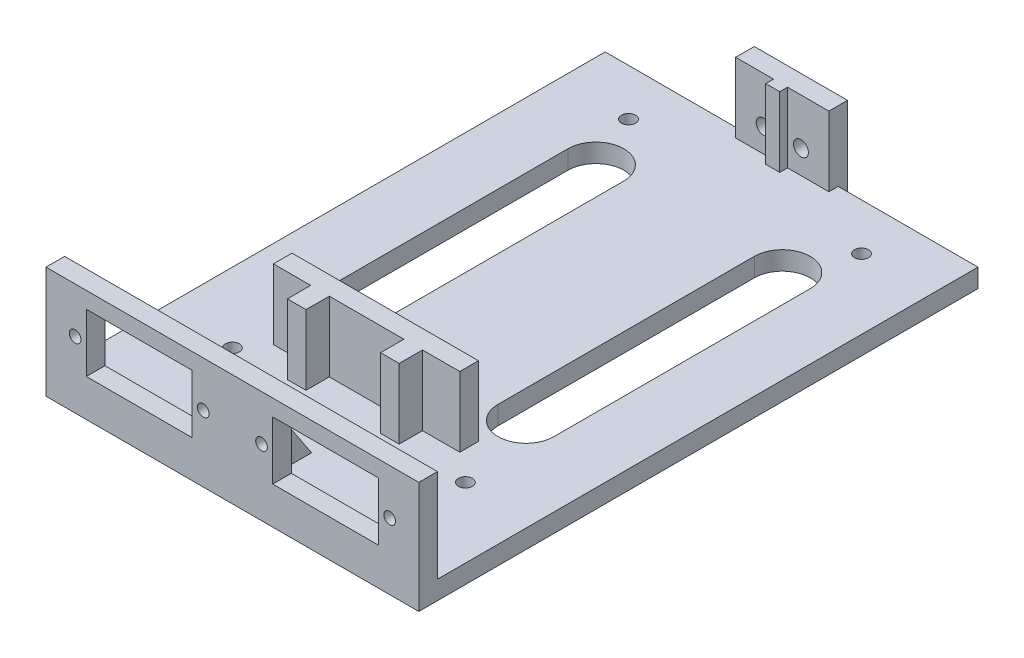
from build123d import *
from build123d.topology import SkipClean

# Parameters (mm, degrees)
SKETCH_1_W           = 80
SKETCH_1_H           = 120
SKETCH_1_R           = 1.5
EXTRUDE_2_DEPTH      = 4
SKETCH_4_W           = 4
SKETCH_4_H           = 10
EXTRUDE_4_DEPTH      = 20
EXTRUDE_5_DEPTH      = 15
EXTRUDE_5_DEPTH_BACK = 10
SKETCH_5_W           = 20
SKETCH_5_H           = 4
CUT_EXTRUDE_1_REACH  = 132.959
SKETCH_6_R           = 1.6
CUT_EXTRUDE_START    = -50
CUT_EXTRUDE_3_DEPTH  = 50
EXTRUDE_7_DEPTH      = 15
EXTRUDE_7_DEPTH_BACK = 10
SKETCH_10_W          = 3
SKETCH_10_H          = 3
SKETCH_11_W          = 4
SKETCH_11_H          = 5
EXTRUDE_9_DEPTH      = 15
CUT_EXTRUDE_5_REACH  = 102.708
CUT_EXTRUDE_6_REACH  = 129.241
SKETCH_13_R          = 1.25
SKETCH_13_W          = 22.7
SKETCH_13_H          = 12.5
CUT_EXTRUDE_7_DEPTH  = 114.370984798
SKETCH_15_W          = 6
SKETCH_15_H          = 10
EXTRUDE_10_DEPTH     = 15
CUT_EXTRUDE_8_REACH  = 104.357
EXTRUDE_START        = 3
SKETCH_17_R          = 3
SKETCH_17_R_2        = 1.5
EXTRUDE_11_DEPTH     = 3


with BuildPart() as part:
    # 草图1 → 凸台-拉伸2 (new body)
    with BuildSketch(Plane(origin=(0, 0, 0), x_dir=(1, 0, 0), z_dir=(0, 1, 0))):
        with Locations((1.11138133, -29.732826736)):
            Rectangle(SKETCH_1_W, SKETCH_1_H)
        with Locations(Location((-23.88861867, 20.267173264, 0), (0, 0, 270))):
            Circle(SKETCH_1_R, mode=Mode.SUBTRACT)
        with Locations(Location((26.11138133, 20.267173264, 0), (0, 0, 270))):
            Circle(SKETCH_1_R, mode=Mode.SUBTRACT)
        with Locations(Location((-23.88861867, -64.732826736, 0), (0, 0, 270))):
            Circle(SKETCH_1_R, mode=Mode.SUBTRACT)
        with Locations(Location((26.11138133, -64.732826736, 0), (0, 0, 270))):
            Circle(SKETCH_1_R, mode=Mode.SUBTRACT)
    extrude(amount=EXTRUDE_2_DEPTH)

    # 草图4 → 凸台-拉伸4 (add)
    with BuildSketch(Plane(origin=(0, 4, 0), x_dir=(1, 0, 0), z_dir=(0, 1, 0))):
        Polygon((-38.88861867, -85.732826736), (-38.88861867, -89.732826736), (41.11138133, -89.732826736), (41.11138133, -85.732826736), (26.11138133, -85.732826736), (22.11138133, -85.732826736), (-19.88861867, -85.732826736), (-23.88861867, -85.732826736), align=None)
        with Locations((24.11138133, -80.732826736)):
            Rectangle(SKETCH_4_W, SKETCH_4_H)
        with Locations((-21.88861867, -80.732826736)):
            Rectangle(SKETCH_4_W, SKETCH_4_H)
    extrude(amount=EXTRUDE_4_DEPTH)

    # 草图5 → 凸台-拉伸5 (add, two sides: drawn at the far end of the back side and taken through both)
    with BuildSketch(Plane(origin=(0, 4, 0), x_dir=(1, 0, 0), z_dir=(0, 1, 0)).offset(-EXTRUDE_5_DEPTH_BACK)):
        with Locations((1.11138133, 30.267173264)):
            Rectangle(SKETCH_5_W, SKETCH_5_H)
    extrude(amount=EXTRUDE_5_DEPTH + EXTRUDE_5_DEPTH_BACK)

    # 草图6 → 切除-拉伸1 (cut, up to next)
    with BuildSketch(Plane(origin=(0, 0, -32.267173264), x_dir=(-1, 0, 0), z_dir=(0, 0, -1)), mode=Mode.PRIVATE) as cut_extrude_1_sk1:
        with Locations((2.88861867, 9.096659339)):
            Circle(SKETCH_6_R)
    cut_extrude_1_tool1 = extrude(cut_extrude_1_sk1.sketch, amount=-CUT_EXTRUDE_1_REACH, mode=Mode.PRIVATE) & part.part
    # 草图6 → 切除-拉伸1 (cut, up to next)
    with BuildSketch(Plane(origin=(0, 0, -32.267173264), x_dir=(-1, 0, 0), z_dir=(0, 0, -1)), mode=Mode.PRIVATE) as cut_extrude_1_sk2:
        with Locations((-5.11138133, 9.096659339)):
            Circle(SKETCH_6_R)
    cut_extrude_1_tool2 = extrude(cut_extrude_1_sk2.sketch, amount=-CUT_EXTRUDE_1_REACH, mode=Mode.PRIVATE) & part.part
    add(cut_extrude_1_tool1.solids().sort_by_distance((-2.888619, 9.096659, -32.267173))[0], mode=Mode.SUBTRACT)
    add(cut_extrude_1_tool2.solids().sort_by_distance((5.111381, 9.096659, -32.267173))[0], mode=Mode.SUBTRACT)

    # 草图9 → 切除-拉伸3 (cut)
    with BuildSketch(Plane.ZY.offset(23.88861867).offset(CUT_EXTRUDE_START)):
        Polygon((75.732826736, 24), (75.732826736, 4), (85.732826736, 14), (85.732826736, 24), align=None)
    extrude(amount=CUT_EXTRUDE_3_DEPTH, mode=Mode.SUBTRACT)

    # 草图10 → 凸台-拉伸7 (add, two sides: drawn at the far end of the back side and taken through both)
    with BuildSketch(Plane(origin=(0, 4, 0), x_dir=(1, 0, 0), z_dir=(0, 1, 0)).offset(-EXTRUDE_7_DEPTH_BACK)):
        with Locations((0.730413479, 28.094677972)):
            Rectangle(SKETCH_10_W, SKETCH_10_H)
    extrude(amount=EXTRUDE_7_DEPTH + EXTRUDE_7_DEPTH_BACK)

    # 草图11 → 凸台-拉伸9 (add)
    with BuildSketch(Plane(origin=(0, 4, 0), x_dir=(1, 0, 0), z_dir=(0, 1, 0))):
        Polygon((19.905778303, -55.732826736), (-20.094221697, -55.732826736), (-20.094221697, -59.732826736), (-12.422102113, -59.732826736), (-12.094221697, -59.732826736), (-9.202998314, -59.732826736), (-8.094221697, -59.732826736), (7.905778303, -59.732826736), (11.905778303, -59.732826736), (19.905778303, -59.732826736), align=None)
        Polygon((-9.202998314, -59.732826736), (-12.094221697, -59.732826736), (-12.094221697, -64.732826736), (-8.094221697, -64.732826736), (-8.094221697, -59.732826736), align=None)
        with Locations((9.905778303, -62.232826736)):
            Rectangle(SKETCH_11_W, SKETCH_11_H)
    extrude(amount=EXTRUDE_9_DEPTH)

    # 草图12 → 切除-拉伸5 (cut, up to next)
    with BuildSketch(Plane(origin=(0, 4, 0), x_dir=(1, 0, 0), z_dir=(0, 1, 0)), mode=Mode.PRIVATE) as cut_extrude_5_sk1:
        with BuildLine():
            Line((27.11138133, 8.267173264), (27.11138133, -46.732826736))
            ThreePointArc((27.11138133, -46.732826736), (21.11138133, -52.732826736), (15.11138133, -46.732826736))
            Line((15.11138133, -46.732826736), (15.11138133, 8.267173264))
            ThreePointArc((15.11138133, 8.267173264), (21.11138133, 14.267173264), (27.11138133, 8.267173264))
        make_face()
    cut_extrude_5_tool1 = extrude(cut_extrude_5_sk1.sketch, amount=-CUT_EXTRUDE_5_REACH, mode=Mode.PRIVATE) & part.part
    # 草图12 → 切除-拉伸5 (cut, up to next)
    with BuildSketch(Plane(origin=(0, 4, 0), x_dir=(1, 0, 0), z_dir=(0, 1, 0)), mode=Mode.PRIVATE) as cut_extrude_5_sk2:
        with BuildLine():
            Line((-12.88861867, 8.267173264), (-12.88861867, -46.732826736))
            ThreePointArc((-12.88861867, -46.732826736), (-18.88861867, -52.732826736), (-24.88861867, -46.732826736))
            Line((-24.88861867, -46.732826736), (-24.88861867, 8.267173264))
            ThreePointArc((-24.88861867, 8.267173264), (-18.88861867, 14.267173264), (-12.88861867, 8.267173264))
        make_face()
    cut_extrude_5_tool2 = extrude(cut_extrude_5_sk2.sketch, amount=-CUT_EXTRUDE_5_REACH, mode=Mode.PRIVATE) & part.part
    add(cut_extrude_5_tool1.solids().sort_by_distance((21.111381, 4, 19.232827))[0], mode=Mode.SUBTRACT)
    add(cut_extrude_5_tool2.solids().sort_by_distance((-18.888619, 4, 19.232827))[0], mode=Mode.SUBTRACT)

    # 草图13 → 切除-拉伸6 (cut, up to next)
    with BuildSketch(Plane(origin=(0, 0, 85.732826736), x_dir=(-1, 0, 0), z_dir=(0, 0, -1)), mode=Mode.PRIVATE) as cut_extrude_6_sk1:
        with Locations((-34.86138133, 14.25)):
            Circle(SKETCH_13_R)
    cut_extrude_6_tool1 = extrude(cut_extrude_6_sk1.sketch, amount=-CUT_EXTRUDE_6_REACH, mode=Mode.PRIVATE) & part.part
    # 草图13 → 切除-拉伸6 (cut, up to next)
    with BuildSketch(Plane(origin=(0, 0, 85.732826736), x_dir=(-1, 0, 0), z_dir=(0, 0, -1)), mode=Mode.PRIVATE) as cut_extrude_6_sk2:
        with Locations((-7.36138133, 14.25)):
            Circle(SKETCH_13_R)
    cut_extrude_6_tool2 = extrude(cut_extrude_6_sk2.sketch, amount=-CUT_EXTRUDE_6_REACH, mode=Mode.PRIVATE) & part.part
    # 草图13 → 切除-拉伸6 (cut, up to next)
    with BuildSketch(Plane(origin=(0, 0, 85.732826736), x_dir=(-1, 0, 0), z_dir=(0, 0, -1)), mode=Mode.PRIVATE) as cut_extrude_6_sk3:
        with Locations((5.13861867, 14.25)):
            Circle(SKETCH_13_R)
    cut_extrude_6_tool3 = extrude(cut_extrude_6_sk3.sketch, amount=-CUT_EXTRUDE_6_REACH, mode=Mode.PRIVATE) & part.part
    # 草图13 → 切除-拉伸6 (cut, up to next)
    with BuildSketch(Plane(origin=(0, 0, 85.732826736), x_dir=(-1, 0, 0), z_dir=(0, 0, -1)), mode=Mode.PRIVATE) as cut_extrude_6_sk4:
        with Locations((32.63861867, 14.25)):
            Circle(SKETCH_13_R)
    cut_extrude_6_tool4 = extrude(cut_extrude_6_sk4.sketch, amount=-CUT_EXTRUDE_6_REACH, mode=Mode.PRIVATE) & part.part
    # 草图13 → 切除-拉伸6 (cut, up to next)
    with BuildSketch(Plane(origin=(0, 0, 85.732826736), x_dir=(-1, 0, 0), z_dir=(0, 0, -1)), mode=Mode.PRIVATE) as cut_extrude_6_sk5:
        with Locations((-21.11138133, 14.25)):
            Rectangle(SKETCH_13_W, SKETCH_13_H)
    cut_extrude_6_tool5 = extrude(cut_extrude_6_sk5.sketch, amount=-CUT_EXTRUDE_6_REACH, mode=Mode.PRIVATE) & part.part
    # 草图13 → 切除-拉伸6 (cut, up to next)
    with BuildSketch(Plane(origin=(0, 0, 85.732826736), x_dir=(-1, 0, 0), z_dir=(0, 0, -1)), mode=Mode.PRIVATE) as cut_extrude_6_sk6:
        with Locations((18.88861867, 14.25)):
            Rectangle(SKETCH_13_W, SKETCH_13_H)
    cut_extrude_6_tool6 = extrude(cut_extrude_6_sk6.sketch, amount=-CUT_EXTRUDE_6_REACH, mode=Mode.PRIVATE) & part.part
    add(cut_extrude_6_tool1.solids().sort_by_distance((34.861381, 14.25, 85.732827))[0], mode=Mode.SUBTRACT)
    add(cut_extrude_6_tool2.solids().sort_by_distance((7.361381, 14.25, 85.732827))[0], mode=Mode.SUBTRACT)
    add(cut_extrude_6_tool3.solids().sort_by_distance((-5.138619, 14.25, 85.732827))[0], mode=Mode.SUBTRACT)
    add(cut_extrude_6_tool4.solids().sort_by_distance((-32.638619, 14.25, 85.732827))[0], mode=Mode.SUBTRACT)
    add(cut_extrude_6_tool5.solids().sort_by_distance((21.111381, 14.25, 85.732827))[0], mode=Mode.SUBTRACT)
    add(cut_extrude_6_tool6.solids().sort_by_distance((-18.888619, 14.25, 85.732827))[0], mode=Mode.SUBTRACT)

    # 草图14 → 切除-拉伸7 (cut, through all)
    with BuildSketch(Plane(origin=(26.11138133, 0, 0), x_dir=(0, 0, -1), z_dir=(1, 0, 0))):
        Polygon((-85.732826736, 4), (-75.732826736, 4), (-85.732826736, 14), (-85.732826736, 8), align=None)
    extrude(amount=-CUT_EXTRUDE_7_DEPTH, mode=Mode.SUBTRACT)

    # 草图15 → 凸台-拉伸10 (add)
    with BuildSketch(Plane(origin=(0, 4, 0), x_dir=(1, 0, 0), z_dir=(0, 1, 0))):
        with Locations((1.11138133, -80.732826736)):
            Rectangle(SKETCH_15_W, SKETCH_15_H)
    extrude(amount=EXTRUDE_10_DEPTH)

    # 草图16 → 切除-拉伸8 (cut, up to next)
    with BuildSketch(Plane(origin=(4.11138133, 0, 0), x_dir=(0, 0, -1), z_dir=(1, 0, 0)), mode=Mode.PRIVATE) as cut_extrude_8_sk1:
        Polygon((-85.732826736, 19), (-75.732826736, 4), (-75.732826736, 19), align=None)
    cut_extrude_8_tool1 = extrude(cut_extrude_8_sk1.sketch, amount=-CUT_EXTRUDE_8_REACH, mode=Mode.PRIVATE) & part.part
    add(cut_extrude_8_tool1.solids().sort_by_distance((4.111381, 14, 79.06616))[0], mode=Mode.SUBTRACT)

    # 草图17 → 凸台-拉伸11 (add)
    # profile 1 of 4: a face of its own
    with SkipClean():  # the faces are left unmerged after this step: merging them gives an invalid solid
        with BuildSketch(Plane.XZ.offset(EXTRUDE_START)):
            with Locations(Location((-23.88861867, 64.732826736, 0), (0, 0, 90))):
                Circle(SKETCH_17_R)
            with Locations(Location((-23.88861867, 64.732826736, 0), (0, 0, 270))):
                Circle(SKETCH_17_R_2, mode=Mode.SUBTRACT)
        # profile 2 of 4: a face of its own
        with BuildSketch(Plane.XZ.offset(EXTRUDE_START)):
            with Locations(Location((26.11138133, 64.732826736, 0), (0, 0, 90))):
                Circle(SKETCH_17_R)
            with Locations(Location((26.11138133, 64.732826736, 0), (0, 0, 270))):
                Circle(SKETCH_17_R_2, mode=Mode.SUBTRACT)
        # profile 3 of 4: a face of its own
        with BuildSketch(Plane.XZ.offset(EXTRUDE_START)):
            with Locations(Location((26.11138133, -20.267173264, 0), (0, 0, 90))):
                Circle(SKETCH_17_R)
            with Locations(Location((26.11138133, -20.267173264, 0), (0, 0, 270))):
                Circle(SKETCH_17_R_2, mode=Mode.SUBTRACT)
        # profile 4 of 4: a face of its own
        with BuildSketch(Plane.XZ.offset(EXTRUDE_START)):
            with Locations(Location((-23.88861867, -20.267173264, 0), (0, 0, 90))):
                Circle(SKETCH_17_R)
            with Locations(Location((-23.88861867, -20.267173264, 0), (0, 0, 270))):
                Circle(SKETCH_17_R_2, mode=Mode.SUBTRACT)
        extrude(amount=-EXTRUDE_11_DEPTH)


solid = part.part
